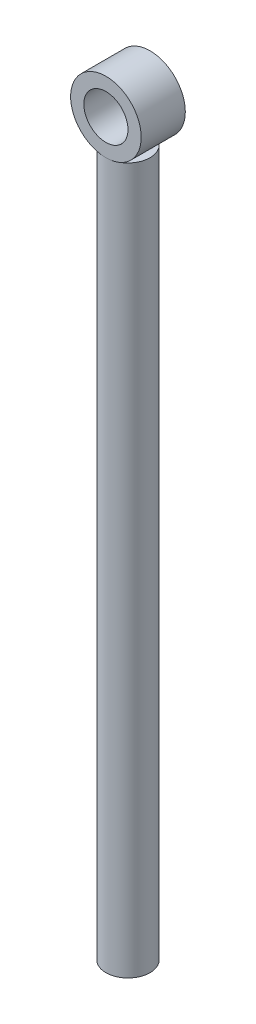
from build123d import *

# Parameters (mm, degrees)
SKETCH1_R           = 3.175
BOSS_EXTRUDE1_DEPTH = 50.8
SKETCH2_R           = 5.08
SKETCH2_R_2         = 3.175
BOSS_EXTRUDE2_DEPTH = 3.175


with BuildPart() as part:
    # Sketch1 → Boss-Extrude1 (new, symmetric)
    with BuildSketch(Plane(origin=(0, 0, 0), x_dir=(1, 0, 0), z_dir=(0, 1, 0))):
        with Locations(Location((0, 0, 0), (0, 0, 270))):
            Circle(SKETCH1_R)
    extrude(amount=BOSS_EXTRUDE1_DEPTH, both=True)


with BuildPart() as body_2:
    # Sketch2 → Boss-Extrude2 (new, symmetric)
    with BuildSketch(Plane.XY):
        with Locations((0, 55.88)):
            Circle(SKETCH2_R)
        with Locations((0, 55.88)):
            Circle(SKETCH2_R_2, mode=Mode.SUBTRACT)
    extrude(amount=BOSS_EXTRUDE2_DEPTH, both=True)


solid = Compound([part.part, body_2.part])
